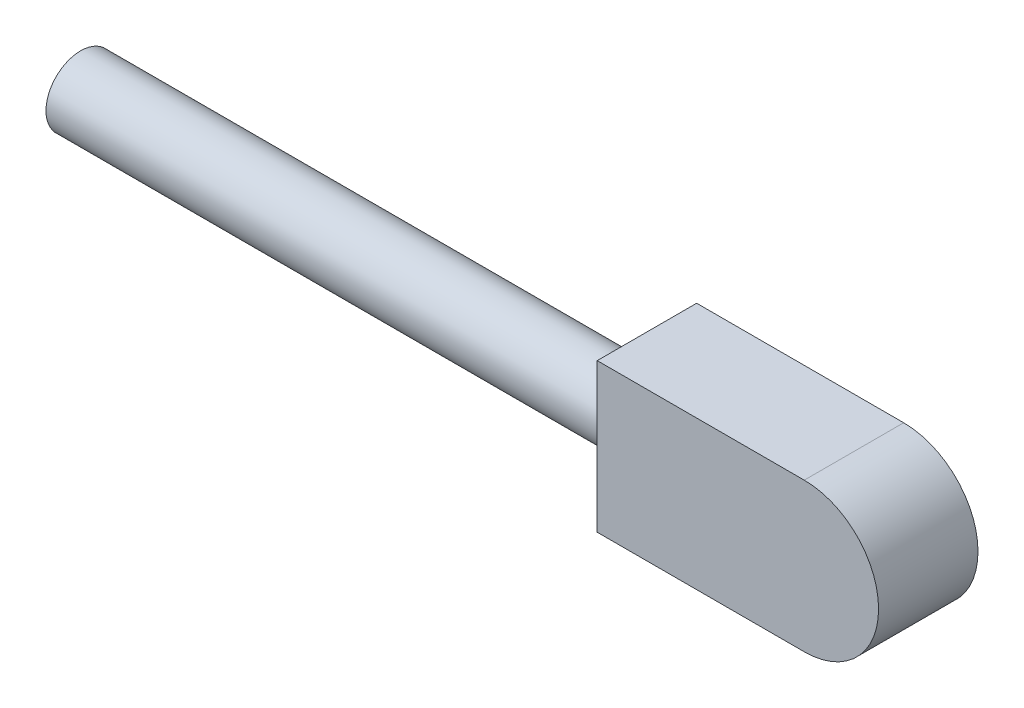
from build123d import *

# Parameters (mm, degrees)
BASE_EXTRUDE_DEPTH      = 40.132
BASE_EXTRUDE_DEPTH_BACK = 40.132
SKETCH5_R               = 27.94
BOSS_EXTRUDE1_DEPTH     = 457.2


with BuildPart() as part:
    # Sketch4 → Base-Extrude (new, two sides: drawn at the far end of the back side and taken through both)
    with BuildSketch(Plane.XY.offset(-BASE_EXTRUDE_DEPTH_BACK)):
        with BuildLine():
            Line((0.868, 60), (168, 60))
            ThreePointArc((168, 60), (228, 0), (168, -60))
            Line((168, -60), (0.868, -60))
            Line((0.868, -60), (0.868, 60))
        make_face()
    extrude(amount=BASE_EXTRUDE_DEPTH + BASE_EXTRUDE_DEPTH_BACK)

    # Sketch5 → Boss-Extrude1 (add)
    with BuildSketch(Plane.ZY.offset(-0.868)):
        Circle(SKETCH5_R)
    extrude(amount=BOSS_EXTRUDE1_DEPTH)


solid = part.part
